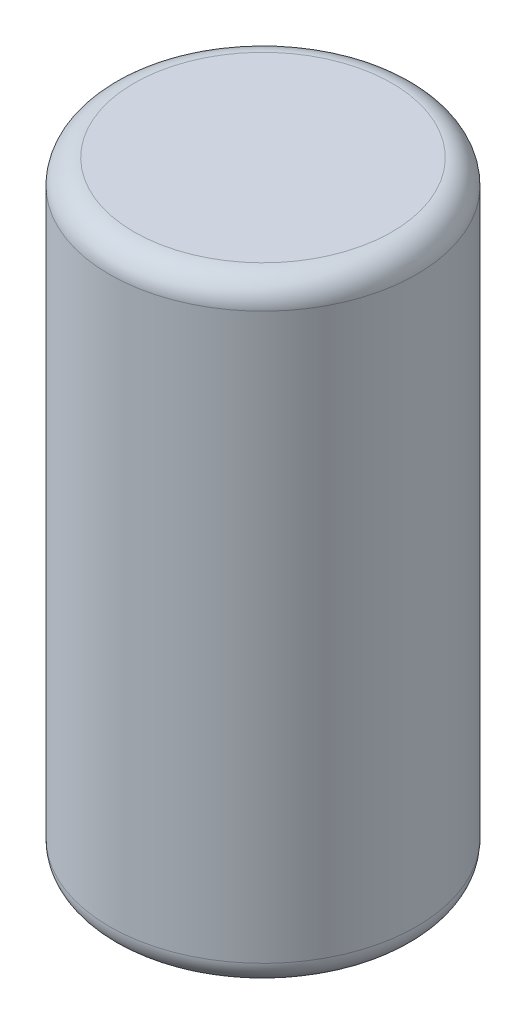
from build123d import *

# Parameters (mm, degrees)
SKETCH1_R           = 62.5
BOSS_EXTRUDE1_DEPTH = 250
FILLET3_R           = 10


with BuildPart() as part:
    # Sketch1 → Boss-Extrude1 (new body)
    with BuildSketch(Plane(origin=(0, 0, 0), x_dir=(1, 0, 0), z_dir=(0, 1, 0))):
        with Locations(Location((0, 0, 0), (0, 0, 270))):
            Circle(SKETCH1_R)
    extrude(amount=BOSS_EXTRUDE1_DEPTH)

    # Fillet3
    fillet3_edges = [part.edges().sort_by_distance(p)[0] for p in [
        (0, 0, -62.5),
        (0, 250, -62.5),
    ]]
    fillet(fillet3_edges, radius=FILLET3_R)


solid = part.part
